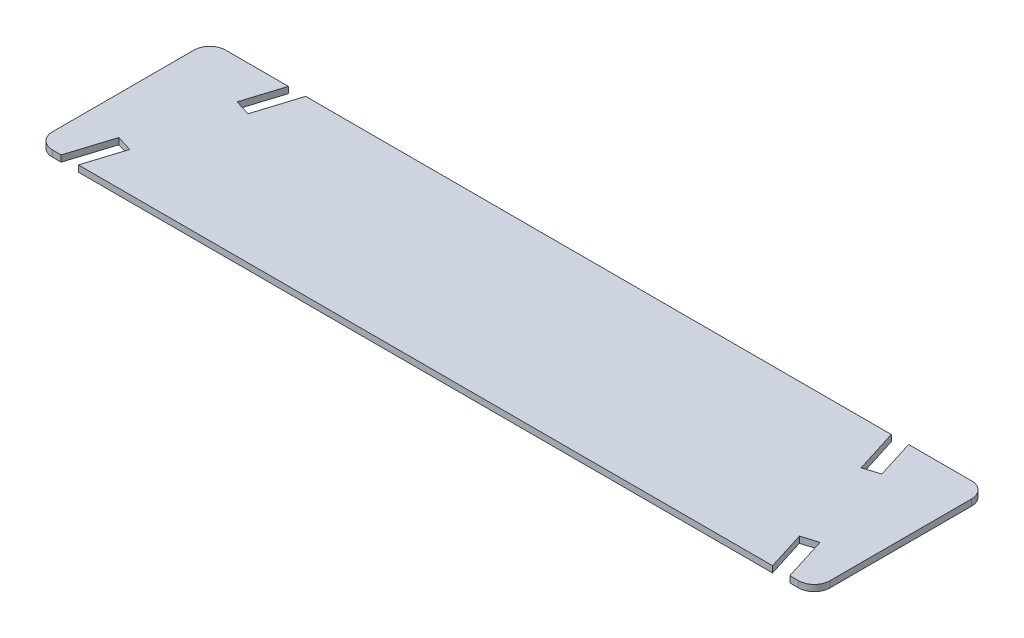
from build123d import *

# Parameters (mm, degrees)
BOSS_EXTRUDE1_DEPTH = 2


with BuildPart() as part:
    # Sketch1 → Boss-Extrude1 (new body)
    with BuildSketch(Plane(origin=(0, 0, 0), x_dir=(1, 0, 0), z_dir=(0, 1, 0))):
        with BuildLine():
            Line((25, 55), (21.109165494, 42.59796501))
            Line((21.109165494, 42.59796501), (26.118434554, 41.026429618))
            Line((26.118434554, 41.026429618), (30.502299771, 55))
            Line((30.502299771, 55), (216.654895807, 55))
            Line((216.654895807, 55), (221.038761024, 41.026429618))
            Line((221.038761024, 41.026429618), (226.048030084, 42.59796501))
            Line((226.048030084, 42.59796501), (222.157195577, 55))
            Line((222.157195577, 55), (242.157195577, 55))
            ThreePointArc((242.157195577, 55), (245.692729483, 53.535533906), (247.157195577, 50))
            Line((247.157195577, 50), (247.157195577, 5))
            ThreePointArc((247.157195577, 5), (245.692729483, 1.464466094), (242.157195577, 0))
            Line((242.157195577, 0), (239.412097536, 0))
            Line((239.412097536, 0), (235.028232319, 13.973570382))
            Line((235.028232319, 13.973570382), (230.018963259, 12.40203499))
            Line((230.018963259, 12.40203499), (233.909797765, 0))
            Line((233.909797765, 0), (13.247397812, 0))
            Line((13.247397812, 0), (17.138232319, 12.40203499))
            Line((17.138232319, 12.40203499), (12.128963259, 13.973570382))
            Line((12.128963259, 13.973570382), (7.745098042, 0))
            Line((7.745098042, 0), (5, 0))
            ThreePointArc((5, 0), (1.464466094, 1.464466094), (0, 5))
            Line((0, 5), (0, 50))
            ThreePointArc((0, 50), (1.464466094, 53.535533906), (5, 55))
            Line((5, 55), (25, 55))
        make_face()
    extrude(amount=BOSS_EXTRUDE1_DEPTH)


solid = part.part
